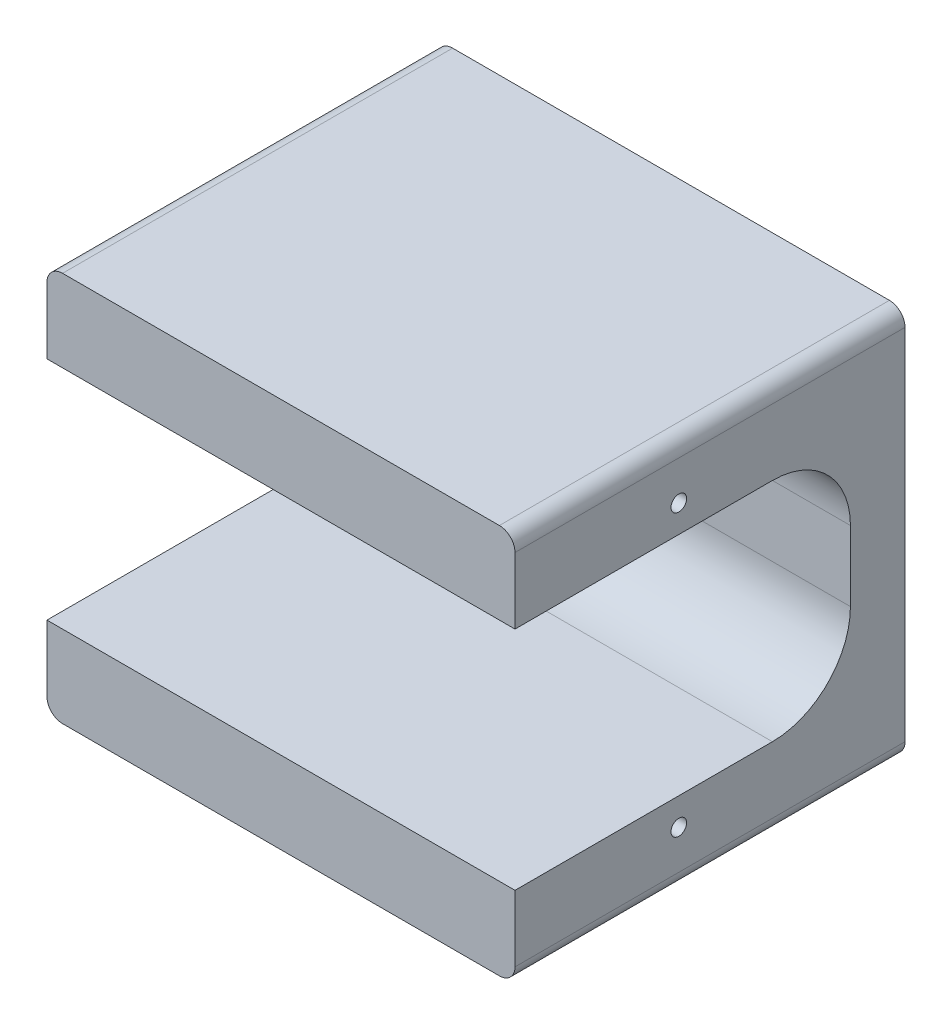
from build123d import *

# Parameters (mm, degrees)
ESBO_O1_W                = 60
ESBO_O1_H                = 50
RESSALTO_EXTRUS_O1_DEPTH = 50
ESBO_O2_W                = 60
ESBO_O2_H                = 29
CORTE_EXTRUS_O1_DEPTH    = 43
FILETE1_R                = 10
FILETE2_R                = 2
ESBO_O3_R                = 1
CORTE_EXTRUS_O2_DEPTH    = 10


with BuildPart() as part:
    # Esboço1 → Ressalto-extrusão1 (new body)
    with BuildSketch(Plane.XY):
        Rectangle(ESBO_O1_W, ESBO_O1_H)
    extrude(amount=RESSALTO_EXTRUS_O1_DEPTH)

    # Esboço2 → Corte-extrusão1 (cut)
    with BuildSketch(Plane.XY.offset(50)):
        Rectangle(ESBO_O2_W, ESBO_O2_H)
    extrude(amount=-CORTE_EXTRUS_O1_DEPTH, mode=Mode.SUBTRACT)

    # Filete1
    filete1_edges = [part.edges().sort_by_distance(p)[0] for p in [
        (0, -14.5, 7),
        (0, 14.5, 7),
    ]]
    fillet(filete1_edges, radius=FILETE1_R)

    # Filete2
    filete2_edges = [part.edges().sort_by_distance(p)[0] for p in [
        (30, -25, 25),
        (-30, -25, 25),
        (-30, 25, 25),
        (30, 25, 25),
    ]]
    fillet(filete2_edges, radius=FILETE2_R)

    # Esboço3 → Corte-extrusão2 (cut)
    with BuildSketch(Plane(origin=(30, 0, 0), x_dir=(0, 0, -1), z_dir=(1, 0, 0))):
        with Locations((-29, -18)):
            Circle(ESBO_O3_R)
        with Locations(Location((-29, 18, 0), (0, 0, 180))):
            Circle(ESBO_O3_R)
    corte_extrus_o2 = extrude(amount=-CORTE_EXTRUS_O2_DEPTH, mode=Mode.SUBTRACT)

    # Espelhar1: Corte-extrusão2 across plane
    add(corte_extrus_o2.mirror(Plane.ZY), mode=Mode.SUBTRACT)


solid = part.part
